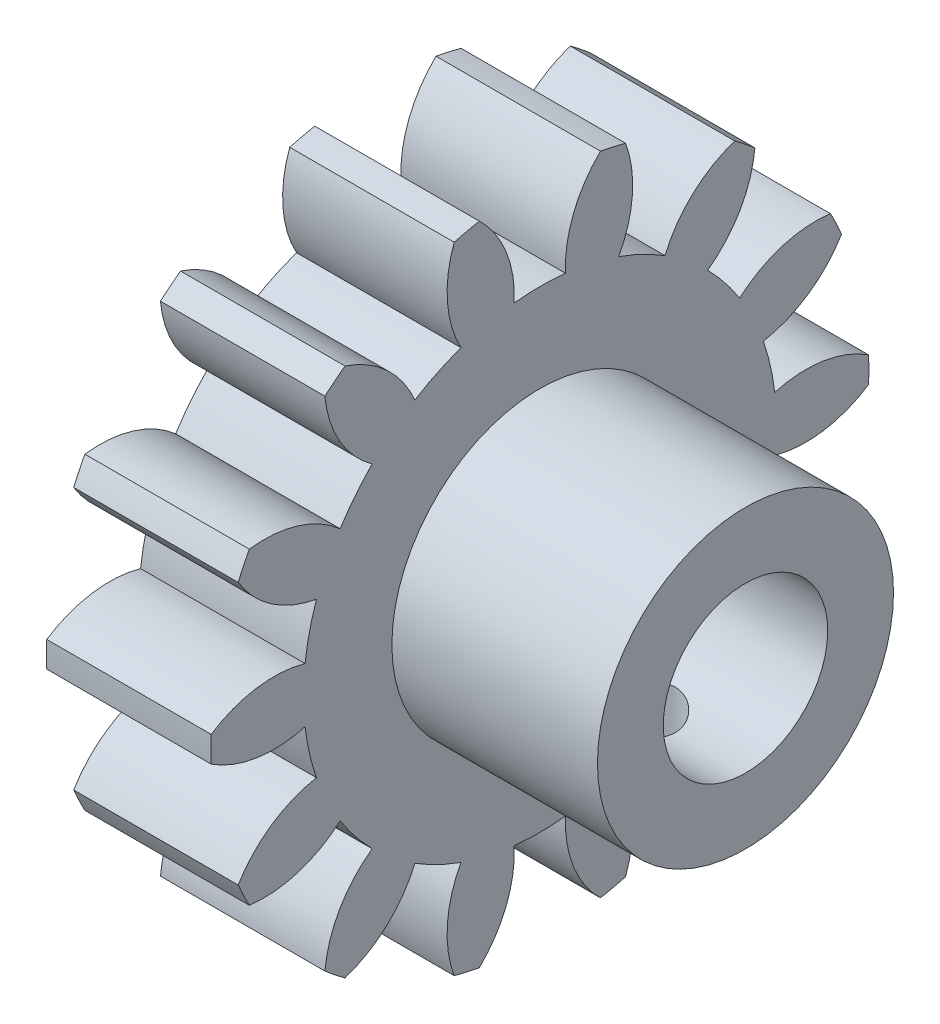
from build123d import *

# Parameters (mm, degrees)
BASPROSKE_W             = 10
BASPROSKE_H             = 20
TOOTHCUT_DEPTH          = 31
TEETHCUTS_COUNT         = 14
TEETHCUTS_ANGLE         = 334.285714286
BORSKE_R                = 5
BORE_DEPTH              = 50.0000508
BOSS_EXTRU_1_START      = 12.5
ESQUISSE1_R             = 9
ESQUISSE1_R_2           = 5
BOSS_EXTRU_1_DEPTH      = 12.5
ESQUISSE2_R             = 1.980815445
ENL_V_MAT_EXTRU_1_DEPTH = 12.5


with BuildPart() as part:
    # BasProSke → Base-Revolve (revolve)
    with BuildSketch(Plane(origin=(0, 0, 0), x_dir=(1, 0, 0), z_dir=(0, 1, 0)), mode=Mode.PRIVATE) as base_revolve_sk:
        with Locations((5, 10)):
            Rectangle(BASPROSKE_W, BASPROSKE_H)
    revolve(base_revolve_sk.sketch.rotate(Axis((-10, 0, 0), (1, 0, 0)), 180), axis=Axis((-10, 0, 0), (1, 0, 0)))

    # TooCutSke → ToothCut (cut, through all)
    with BuildSketch(Plane(origin=(0, 0, 0), x_dir=(0, 0, -1), z_dir=(1, 0, 0))):
        with BuildLine():
            ThreePointArc((1.558726024, 14.28923543), (0, 14.374), (-1.558726024, 14.28923543))
            ThreePointArc((-1.558726024, 14.28923543), (-2.047638508, 17.217318907), (-3.706114514, 19.679465449))
            ThreePointArc((-3.706114514, 19.679465449), (0, 20.0254), (3.706114514, 19.679465449))
            ThreePointArc((3.706114514, 19.679465449), (2.047638508, 17.217318907), (1.558726024, 14.28923543))
        make_face()
    toothcut = extrude(amount=TOOTHCUT_DEPTH, mode=Mode.SUBTRACT)

    # TeethCuts: ToothCut ×14 about axis
    teethcuts_axis = Axis((-10, 0, 0), (1, 0, 0))
    for i in range(1, TEETHCUTS_COUNT):
        add(toothcut.rotate(teethcuts_axis, i * TEETHCUTS_ANGLE / (TEETHCUTS_COUNT - 1)), mode=Mode.SUBTRACT)

    # BorSke → Bore (cut, symmetric)
    with BuildSketch(Plane(origin=(0, 0, 0), x_dir=(0, 0, -1), z_dir=(1, 0, 0))):
        with Locations(Location((0, 0, 0), (0, 0, 180))):
            Circle(BORSKE_R)
    extrude(amount=BORE_DEPTH, both=True, mode=Mode.SUBTRACT)

    # Esquisse1 → Boss.-Extru.1 (add)
    with BuildSketch(Plane(origin=(10, 0, 0), x_dir=(0, 0, -1), z_dir=(1, 0, 0)).offset(BOSS_EXTRU_1_START)):
        with Locations(Location((0, 0, 0), (0, 0, 180))):
            Circle(ESQUISSE1_R)
        Circle(ESQUISSE1_R_2, mode=Mode.SUBTRACT)
    extrude(amount=-BOSS_EXTRU_1_DEPTH)

    # Esquisse2 → Enlèv. mat.-Extru.1 (cut)
    with BuildSketch(Plane(origin=(0, 0, 0), x_dir=(1, 0, 0), z_dir=(0, 1, 0))):
        with Locations(Location((16.25, 0, 0), (0, 0, 270))):
            Circle(ESQUISSE2_R)
    extrude(amount=-ENL_V_MAT_EXTRU_1_DEPTH, mode=Mode.SUBTRACT)


solid = part.part
